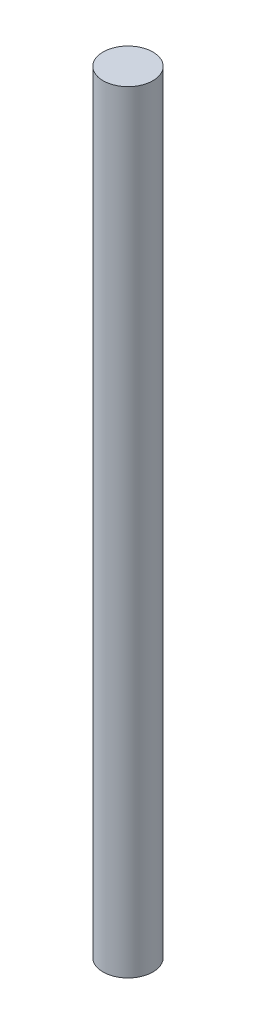
from build123d import *

# Parameters (mm, degrees)
SKETCH_2_R      = 2
EXTRUDE_1_DEPTH = 62


with BuildPart() as part:
    # 草图2 → 凸台-拉伸1 (new body)
    with BuildSketch(Plane(origin=(0, 0, 0), x_dir=(1, 0, 0), z_dir=(0, 1, 0))):
        with Locations(Location((0, 0, 0), (0, 0, 270))):
            Circle(SKETCH_2_R)
    extrude(amount=EXTRUDE_1_DEPTH)


solid = part.part
